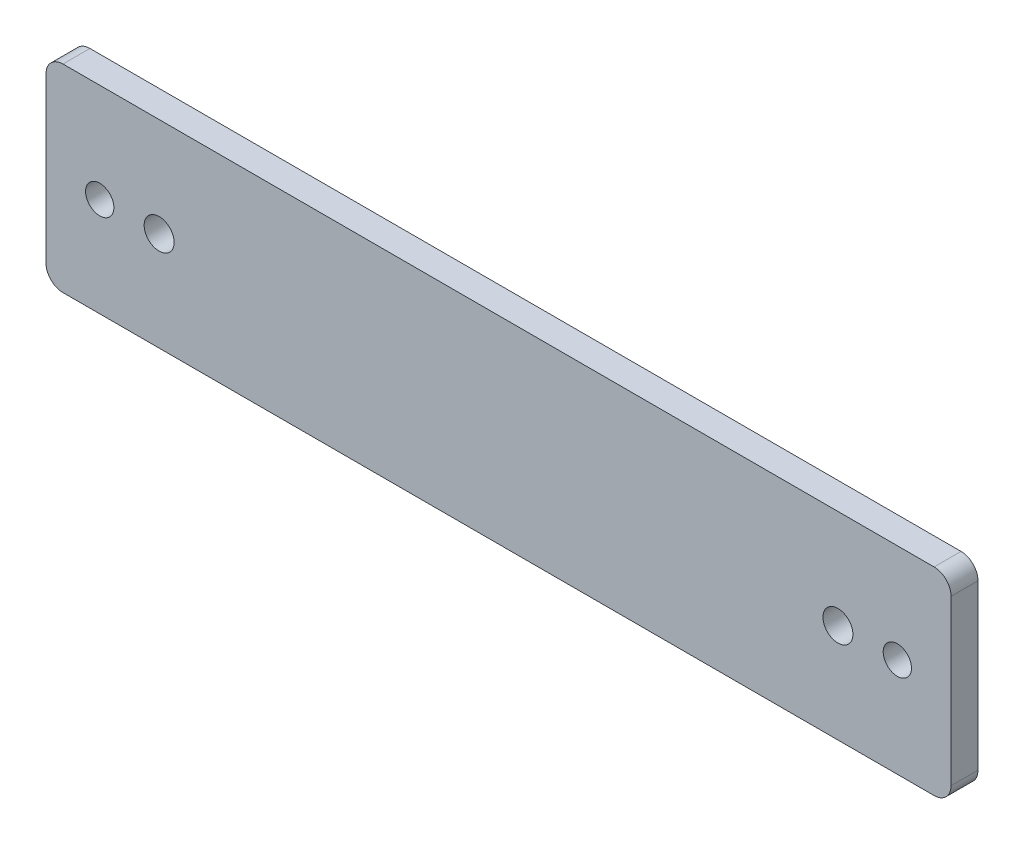
from build123d import *

# Parameters (mm, degrees)
SKETCH1_W            = 160
SKETCH1_H            = 35
SKETCH1_R            = 2.5
BOSS_EXTRUDE1_DEPTH  = 4.7625
M5_CLEARANCE_HOLE1_D = 5.3
FILLET1_R            = 3


with BuildPart() as part:
    # Sketch1 → Boss-Extrude1 (new body)
    with BuildSketch(Plane.XY):
        Rectangle(SKETCH1_W, SKETCH1_H)
        with Locations(Location((-70.5, 0, 0), (0, 0, 180))):
            Circle(SKETCH1_R, mode=Mode.SUBTRACT)
        with Locations(Location((70.5, 0, 0), (0, 0, 180))):
            Circle(SKETCH1_R, mode=Mode.SUBTRACT)
    extrude(amount=BOSS_EXTRUDE1_DEPTH)

    # M5 Clearance Hole1 (through all)
    with Locations(Plane.XY.offset(4.7625)):
        with Locations((-60, 0), (60, 0)):
            Hole(M5_CLEARANCE_HOLE1_D / 2)

    # Fillet1
    fillet1_edges = [part.edges().sort_by_distance(p)[0] for p in [
        (80, -17.5, 2.38125),
        (-80, -17.5, 2.38125),
        (-80, 17.5, 2.38125),
        (80, 17.5, 2.38125),
    ]]
    fillet(fillet1_edges, radius=FILLET1_R)


solid = part.part
